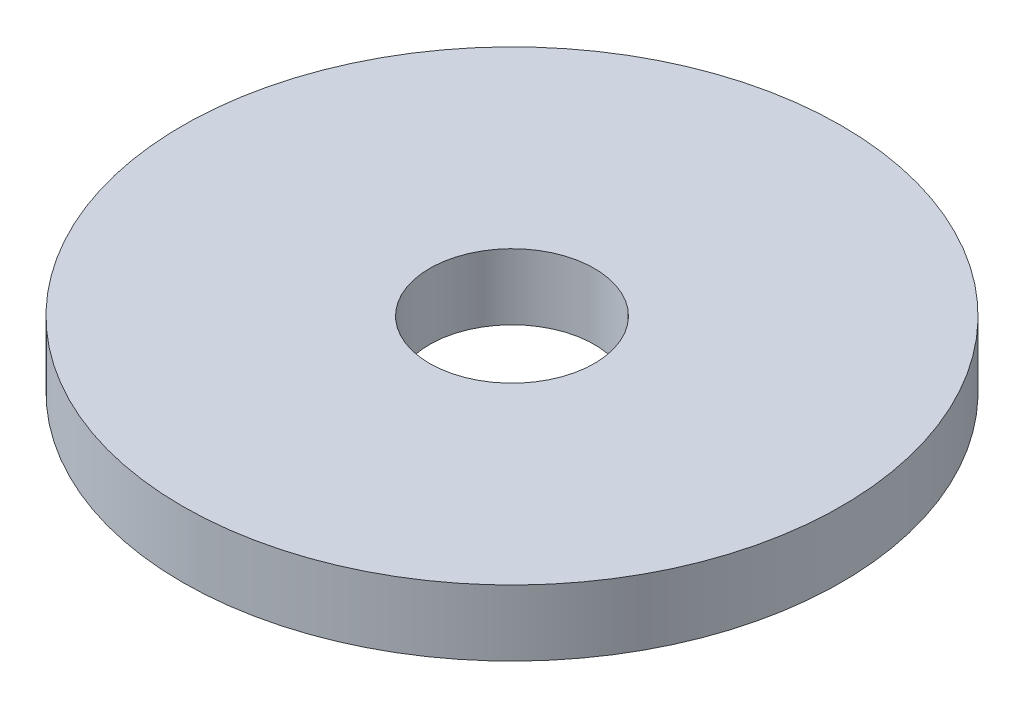
from build123d import *

# Parameters (mm, degrees)
SKETCH_1_R              = 20
EXTRUDE_1_DEPTH         = 4
HOLE_WIZARD_10_0_10_1_D = 10


with BuildPart() as part:
    # 草图1 → 凸台-拉伸1 (new body)
    with BuildSketch(Plane(origin=(0, 0, 0), x_dir=(1, 0, 0), z_dir=(0, 1, 0))):
        with Locations(Location((0, 0, 0), (0, 0, 270))):
            Circle(SKETCH_1_R)
    extrude(amount=EXTRUDE_1_DEPTH)

    # Ø10.0 (10) 直径孔1 (through all)
    with Locations(Plane(origin=(0, 4, 0), x_dir=(1, 0, 0), z_dir=(0, 1, 0))):
        with Locations((0, 0)):
            Hole(HOLE_WIZARD_10_0_10_1_D / 2)


solid = part.part
